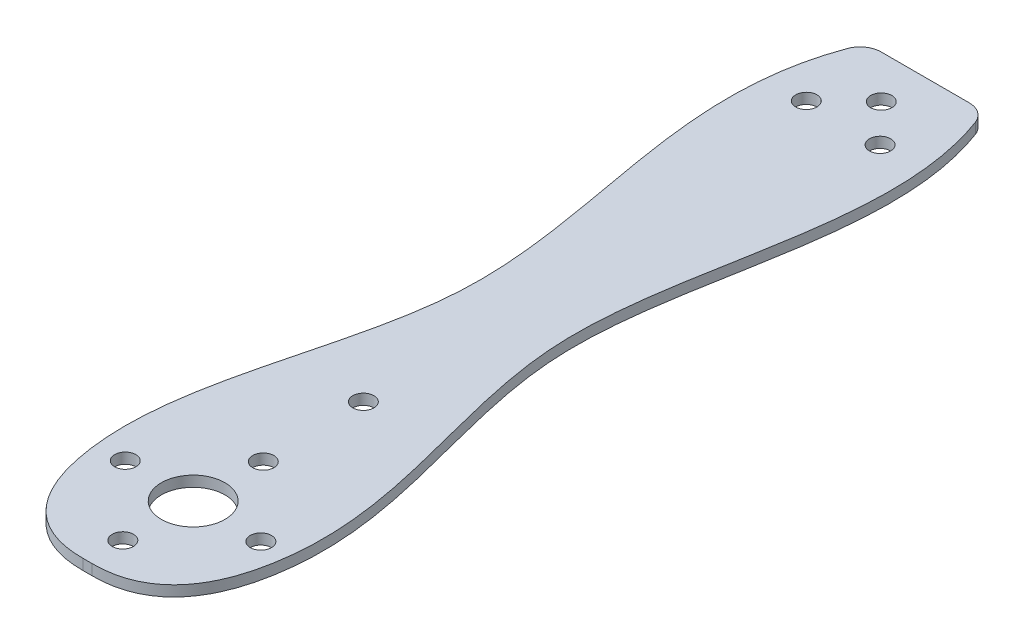
from build123d import *

# Parameters (mm, degrees)
BOSS_EXTRUDE2_DEPTH = 1.27
SKETCH2_R           = 1.27
CUT_EXTRUDE1_DEPTH  = 90.688856727
F_3DSKETCH1_R       = 1.27
F_3DSKETCH1_R_2     = 3.81
CUT_EXTRUDE8_DEPTH  = 81.499781524
SKETCH4_R           = 1.27
CUT_EXTRUDE9_DEPTH  = 90.688856727


with BuildPart() as part:
    # Sketch1 → Boss-Extrude2 (new body)
    with BuildSketch(Plane(origin=(0, 0, 0), x_dir=(1, 0, 0), z_dir=(0, 1, 0))):
        with BuildLine():
            Line((5.275230634, 88.9), (-5.274680514, 88.9))
            ThreePointArc((-5.274680514, 88.9), (-6.725107784, 88.445152449), (-7.656067895, 87.24351239))
            add(Edge.make_bspline(
                [(-0.552393074, -11.443610573), (-4.892105519, -11.469042984), (-9.529424716, -8.066777439), (-14.645892482, 10.818030103), (0.652997254, 38.831677118), (-11.939039637, 68.466563532), (-8.693878789, 84.446234394), (-7.656067895, 87.24351239)],
                knots=[0.003862343, 0.003862343, 0.003862343, 0.003862343, 0.0963537, 0.162148545, 0.527592198, 0.902665046, 0.983926161, 0.983926161, 0.983926161, 0.983926161], degree=3))
            ThreePointArc((-0.552393074, -11.443610573), (-0.003084566, -11.442371375), (0.546218602, -11.445092034))
            add(Edge.make_bspline(
                [(0.546218602, -11.445092034), (4.705642382, -11.480686299), (9.426948295, -8.185590673), (14.781899316, 10.725353159), (-0.687433656, 38.828061669), (11.938501934, 68.466384766), (8.694987433, 84.446805864), (7.656404014, 87.244088984)],
                knots=[0.003867531, 0.003867531, 0.003867531, 0.003867531, 0.093613613, 0.162313612, 0.527685277, 0.902684241, 0.983933931, 0.983933931, 0.983933931, 0.983933931], degree=3))
            ThreePointArc((7.656404014, 87.244088984), (6.725405447, 88.445328034), (5.275230634, 88.9))
        make_face()
    extrude(amount=BOSS_EXTRUDE2_DEPTH)

    # Sketch2 → Cut-Extrude1 (cut, through all)
    with BuildSketch(Plane(origin=(0, 1.27, 0), x_dir=(1, 0, 0), z_dir=(0, 1, 0))):
        with Locations(Location((0, 21.59, 0), (0, 0, 270))):
            Circle(SKETCH2_R)
    extrude(amount=-CUT_EXTRUDE1_DEPTH, mode=Mode.SUBTRACT)

    # 3DSketch1 → Cut-Extrude8 (cut, through all)
    with BuildSketch(Plane(origin=(0.211318445, 3.81, -9.389591413), x_dir=(-0.014463883069433763, 0, 0.99989539257192), z_dir=(0, 1, 0))):
        with Locations(Location((0, 0, 0), (0, 0, 0.828748353))):
            Circle(F_3DSKETCH1_R)
        with Locations(Location((8.293615717, -8.242664201, 0), (0, 0, 0.828748353))):
            Circle(F_3DSKETCH1_R)
        with Locations(Location((8.293615717, 0.012335799, 0), (0, 0, 0.828748353))):
            Circle(F_3DSKETCH1_R_2)
        with Locations(Location((8.318172388, 8.267299274, 0), (0, 0, 0.828748353))):
            Circle(F_3DSKETCH1_R)
        with Locations(Location((16.587231434, 0, 0), (0, 0, 0.828748353))):
            Circle(F_3DSKETCH1_R)
    extrude(amount=-CUT_EXTRUDE8_DEPTH, mode=Mode.SUBTRACT)

    # Sketch4 → Cut-Extrude9 (cut, through all)
    with BuildSketch(Plane(origin=(0, 1.27, 0), x_dir=(1, 0, 0), z_dir=(0, 1, 0))):
        with Locations(Location((-4.684725231, 79.336510379, 0), (0, 0, 270))):
            Circle(SKETCH4_R)
        with Locations(Location((-0.123545977, 83.754444717, 0), (0, 0, 270))):
            Circle(SKETCH4_R)
        with Locations(Location((4.294388361, 79.193265463, 0), (0, 0, 270))):
            Circle(SKETCH4_R)
    extrude(amount=-CUT_EXTRUDE9_DEPTH, mode=Mode.SUBTRACT)


solid = part.part
